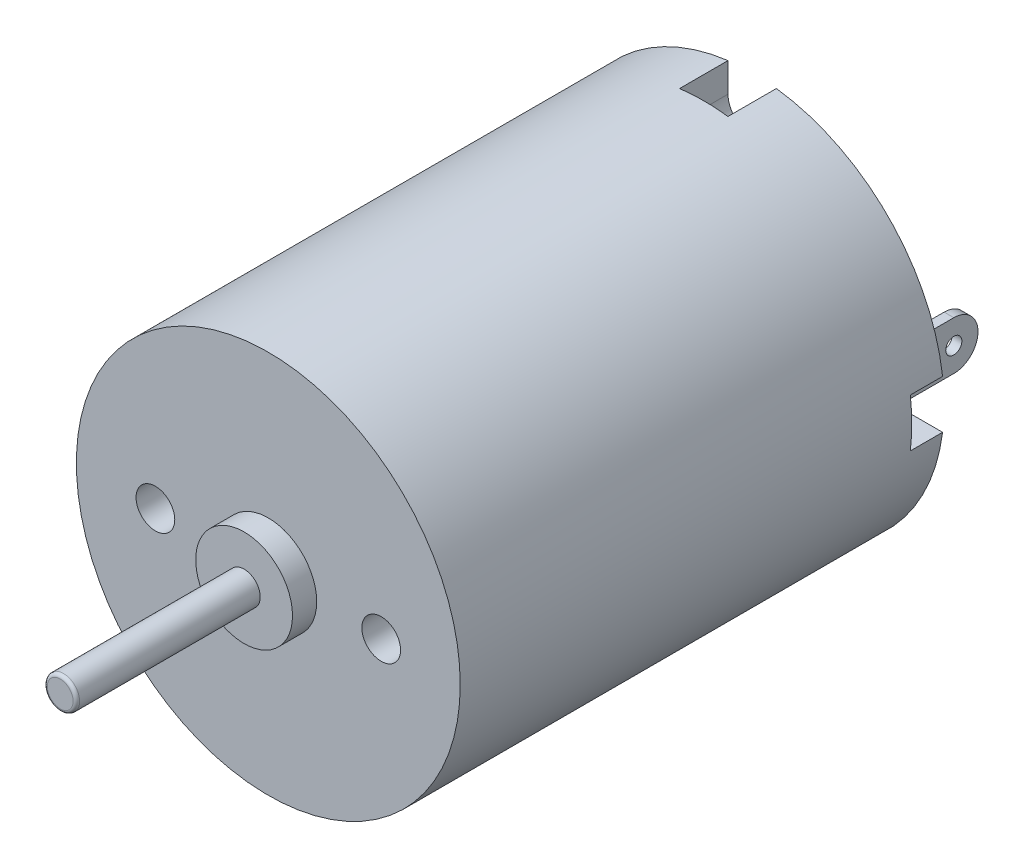
from build123d import *
from build123d.topology import SkipClean

# Parameters (mm, degrees)
CROQUIS2_R              = 11.9
SALIENTE_EXTRUIR1_DEPTH = 30
CROQUIS3_R              = 3
SALIENTE_EXTRUIR2_DEPTH = 1.5
CROQUIS4_R              = 1
CORTAR_EXTRUIR1_DEPTH   = 36.713722853
CROQUIS5_R              = 1.2
CORTAR_EXTRUIR2_DEPTH   = 5
CROQUIS7_R              = 4.5
SALIENTE_EXTRUIR3_DEPTH = 1.7
CORTAR_EXTRUIR3_REACH   = 39.222
CROQUIS8_R              = 1
SALIENTE_EXTRUIR4_DEPTH = 5
CORTAR_EXTRUIR4_REACH   = 41.632
CROQUIS10_R             = 0.5
CORTAR_EXTRUIR5_DEPTH   = 3
CORTAR_EXTRUIR7_DEPTH   = 2
SALIENTE_EXTRUIR5_START = 1
SALIENTE_EXTRUIR5_DEPTH = 1
CROQUIS16_R             = 1
SALIENTE_EXTRUIR8_DEPTH = 0.4
CROQUIS17_R             = 1
SALIENTE_EXTRUIR9_DEPTH = 45
REDONDEO4_R             = 0.2


with BuildPart() as part:
    # Croquis2 → Saliente-Extruir1 (new body)
    with BuildSketch(Plane.XY):
        Circle(CROQUIS2_R)
    extrude(amount=SALIENTE_EXTRUIR1_DEPTH)

    # Croquis3 → Saliente-Extruir2 (add)
    with BuildSketch(Plane.XY.offset(30)):
        Circle(CROQUIS3_R)
    extrude(amount=SALIENTE_EXTRUIR2_DEPTH)

    # Croquis4 → Cortar-Extruir1 (cut, through all)
    with BuildSketch(Plane.XY.offset(31.5)):
        Circle(CROQUIS4_R)
    extrude(amount=-CORTAR_EXTRUIR1_DEPTH, mode=Mode.SUBTRACT)

    # Croquis5 → Cortar-Extruir2 (cut)
    with BuildSketch(Plane.XY.offset(30)):
        with Locations((7, 0)):
            Circle(CROQUIS5_R)
        with Locations((-7, 0)):
            Circle(CROQUIS5_R)
    extrude(amount=-CORTAR_EXTRUIR2_DEPTH, mode=Mode.SUBTRACT)

    # Croquis7 → Saliente-Extruir3 (add)
    with BuildSketch(Plane(origin=(0, 0, 0), x_dir=(-1, 0, 0), z_dir=(0, 0, -1))):
        with Locations(Location((0, 0, 0), (0, 0, 180))):
            Circle(CROQUIS7_R)
    extrude(amount=SALIENTE_EXTRUIR3_DEPTH)

    # Croquis8 → Cortar-Extruir3 (cut, up to next)
    with BuildSketch(Plane(origin=(0, 0, -1.7), x_dir=(-1, 0, 0), z_dir=(0, 0, -1)), mode=Mode.PRIVATE) as cortar_extruir3_sk1:
        with Locations(Location((0, 0, 0), (0, 0, 180))):
            Circle(CROQUIS8_R)
    cortar_extruir3_tool1 = extrude(cortar_extruir3_sk1.sketch, amount=-CORTAR_EXTRUIR3_REACH, mode=Mode.PRIVATE) & part.part
    add(cortar_extruir3_tool1.solids().sort_by_distance((0, 0, -1.7))[0], mode=Mode.SUBTRACT)

    # Croquis9 → Saliente-Extruir4 (add)
    with BuildSketch(Plane(origin=(0, 0, 0), x_dir=(-1, 0, 0), z_dir=(0, 0, -1))):
        Polygon((-9, 0), (-9, 1.5), (-8.4, 1.5), (-8.4, -1.5), (-9, -1.5), align=None)
        Polygon((9, 0), (9, 1.5), (8.4, 1.5), (8.4, -1.5), (9, -1.5), align=None)
    extrude(amount=SALIENTE_EXTRUIR4_DEPTH)

    # Cortar-Extruir4: up to this face of the body (flat: up to its plane)
    cortar_extruir4_end = Plane(part.part.faces().sort_by_distance((9, 0, -2.5))[0])
    # Croquis10 → Cortar-Extruir4 (cut, up to the picked face)
    with BuildSketch(Plane.ZY.offset(9), mode=Mode.PRIVATE) as cortar_extruir4_sk1:
        with BuildLine():
            Line((-5, -1.5), (-3.5, -1.5))
            ThreePointArc((-3.5, -1.5), (-4.560660172, -1.060660172), (-5, 0))
            Line((-5, 0), (-5, -1.5))
        make_face()
    cortar_extruir4_tool1 = split(extrude(cortar_extruir4_sk1.sketch, amount=-CORTAR_EXTRUIR4_REACH, mode=Mode.PRIVATE), bisect_by=cortar_extruir4_end, keep=Keep.BOTH, mode=Mode.PRIVATE)
    # Croquis10 → Cortar-Extruir4 (cut, up to the picked face)
    with BuildSketch(Plane.ZY.offset(9), mode=Mode.PRIVATE) as cortar_extruir4_sk2:
        with BuildLine():
            Line((-5, 1.5), (-5, 0))
            ThreePointArc((-5, 0), (-4.560660172, 1.060660172), (-3.5, 1.5))
            Line((-3.5, 1.5), (-5, 1.5))
        make_face()
    cortar_extruir4_tool2 = split(extrude(cortar_extruir4_sk2.sketch, amount=-CORTAR_EXTRUIR4_REACH, mode=Mode.PRIVATE), bisect_by=cortar_extruir4_end, keep=Keep.BOTH, mode=Mode.PRIVATE)
    # Croquis10 → Cortar-Extruir4 (cut, up to the picked face)
    with BuildSketch(Plane.ZY.offset(9), mode=Mode.PRIVATE) as cortar_extruir4_sk3:
        with Locations((-3.5, 0)):
            Circle(CROQUIS10_R)
    cortar_extruir4_tool3 = split(extrude(cortar_extruir4_sk3.sketch, amount=-CORTAR_EXTRUIR4_REACH, mode=Mode.PRIVATE), bisect_by=cortar_extruir4_end, keep=Keep.BOTH, mode=Mode.PRIVATE)
    add(cortar_extruir4_tool1.solids().sort_by(Axis((-9, -1.164948, -4.664948), (1, 0, 0)))[0], mode=Mode.SUBTRACT)
    add(cortar_extruir4_tool2.solids().sort_by(Axis((-9, 1.164948, -4.664948), (1, 0, 0)))[0], mode=Mode.SUBTRACT)
    add(cortar_extruir4_tool3.solids().sort_by(Axis((-9, 0, -3.5), (1, 0, 0)))[0], mode=Mode.SUBTRACT)

    # Croquis11 → Cortar-Extruir5 (cut)
    with BuildSketch(Plane(origin=(0, 0, 0), x_dir=(-1, 0, 0), z_dir=(0, 0, -1))):
        with BuildLine():
            Line((-1.5, -10), (-1.5, -12.544656971))
            Line((-1.5, -12.544656971), (1.5, -12.544656971))
            Line((1.5, -12.544656971), (1.5, -10))
            ThreePointArc((1.5, -10), (0, -8.5), (-1.5, -10))
        make_face()
        with BuildLine():
            Line((-1.5, 10), (-1.5, 12.84563131))
            Line((-1.5, 12.84563131), (1.5, 12.84563131))
            Line((1.5, 12.84563131), (1.5, 10))
            ThreePointArc((1.5, 10), (0, 8.5), (-1.5, 10))
        make_face()
    extrude(amount=-CORTAR_EXTRUIR5_DEPTH, mode=Mode.SUBTRACT)

    # Croquis12 → Cortar-Extruir7 (cut)
    with SkipClean():  # the faces are left unmerged after this step: merging them gives an invalid solid
        with BuildSketch(Plane(origin=(0, 0, 0), x_dir=(-1, 0, 0), z_dir=(0, 0, -1))):
            with BuildLine():
                Line((-2, 4.031128874), (-2, 7.745966692))
                ThreePointArc((-2, 7.745966692), (-5.835121404, 5.472783405), (-7.858116823, 1.5))
                Line((-7.858116823, 1.5), (-8.4, 1.5))
                Line((-8.4, 1.5), (-8.4, -1.5))
                Line((-8.4, -1.5), (-7.858116823, -1.5))
                ThreePointArc((-7.858116823, -1.5), (-5.835121404, -5.472783405), (-2, -7.745966692))
                Line((-2, -7.745966692), (-2, -4.031128874))
                ThreePointArc((-2, -4.031128874), (-4.5, 0), (-2, 4.031128874))
            make_face()
            with BuildLine():
                Line((2, -4.031128874), (2, -7.745966692))
                ThreePointArc((2, -7.745966692), (5.835121404, -5.472783405), (7.858116823, -1.5))
                Line((7.858116823, -1.5), (8.4, -1.5))
                Line((8.4, -1.5), (8.4, 1.5))
                Line((8.4, 1.5), (7.858116823, 1.5))
                ThreePointArc((7.858116823, 1.5), (5.835121404, 5.472783405), (2, 7.745966692))
                Line((2, 7.745966692), (2, 4.031128874))
                ThreePointArc((2, 4.031128874), (4.5, 0), (2, -4.031128874))
            make_face()
            with BuildLine():
                Line((-9, -1.5), (-9, 1.5))
                Line((-9, 1.5), (-11.805083651, 1.5))
                ThreePointArc((-11.805083651, 1.5), (-11.9, 0), (-11.805083651, -1.5))
                Line((-11.805083651, -1.5), (-9, -1.5))
            make_face()
            with BuildLine():
                Line((9, 1.5), (9, -1.5))
                Line((9, -1.5), (11.805083651, -1.5))
                ThreePointArc((11.805083651, -1.5), (11.9, 0), (11.805083651, 1.5))
                Line((11.805083651, 1.5), (9, 1.5))
            make_face()
        extrude(amount=-CORTAR_EXTRUIR7_DEPTH, mode=Mode.SUBTRACT)

    # Croquis13 → Saliente-Extruir5 (add)
    with SkipClean():  # the faces are left unmerged after this step: merging them gives an invalid solid
        with BuildSketch(Plane(origin=(0, 0, 2), x_dir=(-1, 0, 0), z_dir=(0, 0, -1)).offset(SALIENTE_EXTRUIR5_START)):
            with BuildLine():
                Line((2, 4.582575695), (2, 4.031128874))
                ThreePointArc((2, 4.031128874), (4.5, 0), (2, -4.031128874))
                Line((2, -4.031128874), (2, -4.582575695))
                ThreePointArc((2, -4.582575695), (5, 0), (2, 4.582575695))
            make_face()
            with BuildLine():
                Line((-2, -4.582575695), (-2, -4.031128874))
                ThreePointArc((-2, -4.031128874), (-4.5, 0), (-2, 4.031128874))
                Line((-2, 4.031128874), (-2, 4.582575695))
                ThreePointArc((-2, 4.582575695), (-5, 0), (-2, -4.582575695))
            make_face()
        extrude(amount=-SALIENTE_EXTRUIR5_DEPTH)



with BuildPart() as body_2:
    # Croquis16 → Saliente-Extruir8 (new body)
    with BuildSketch(Plane(origin=(0, 0, -1.7), x_dir=(-1, 0, 0), z_dir=(0, 0, -1))):
        with Locations(Location((0, 0, 0), (0, 0, 180))):
            Circle(CROQUIS16_R)
    extrude(amount=SALIENTE_EXTRUIR8_DEPTH)


with BuildPart() as part_1:
    with SkipClean():  # the faces are left unmerged after this step: merging them gives an invalid solid
        add(part.part)

        add(body_2.part)  # Saliente-Extruir9 merges body 2
        # Croquis17 → Saliente-Extruir9 (add)
        with BuildSketch(Plane(origin=(0, 0, -2.1), x_dir=(-1, 0, 0), z_dir=(0, 0, -1))):
            Circle(CROQUIS17_R)
        extrude(amount=-SALIENTE_EXTRUIR9_DEPTH)

    # Redondeo4
    redondeo4_edges = [part_1.edges().sort_by_distance(p)[0] for p in [
        (1, 0, 42.9),
        (0, -1, -2.1),
    ]]
    fillet(redondeo4_edges, radius=REDONDEO4_R)


solid = part_1.part
